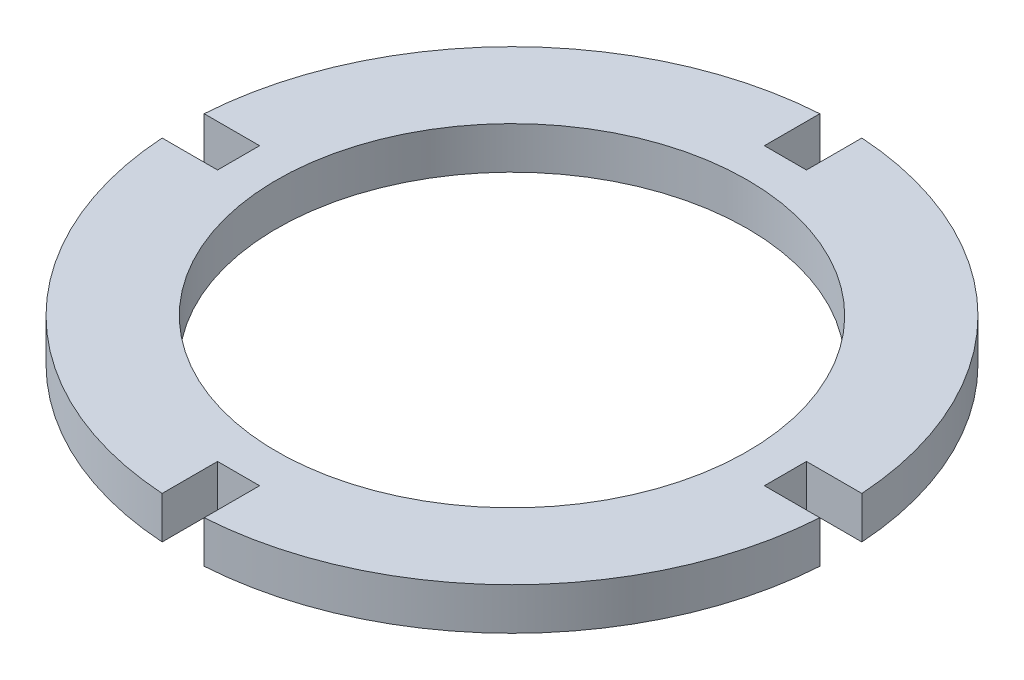
from build123d import *

# Parameters (mm, degrees)
SKICA4_R                 = 23.5
P_IDAT_VYSUNUT_M1_DEPTH  = 3
SKICA6_R                 = 16.78
ODEBRAT_VYSUNUT_M2_DEPTH = 3
SKICA7_W                 = 3
SKICA7_H                 = 6.382195619
SKICA7_W_2               = 6.382195619
SKICA7_H_2               = 3
ODEBRAT_VYSUNUT_M3_DEPTH = 3


with BuildPart() as part:
    # Skica4 → Přidat vysunutím1 (new body)
    with BuildSketch(Plane(origin=(0, 0, 0), x_dir=(1, 0, 0), z_dir=(0, 1, 0))):
        with Locations(Location((0, 0, 0), (0, 0, 270))):
            Circle(SKICA4_R)
    extrude(amount=P_IDAT_VYSUNUT_M1_DEPTH)

    # Skica6 → Odebrat vysunutím2 (cut)
    with BuildSketch(Plane.XZ):
        with Locations(Location((0, 0, 0), (0, 0, 270))):
            Circle(SKICA6_R)
    extrude(amount=-ODEBRAT_VYSUNUT_M2_DEPTH, mode=Mode.SUBTRACT)

    # Skica7 → Odebrat vysunutím3 (cut)
    with BuildSketch(Plane(origin=(0, 3, 0), x_dir=(1, 0, 0), z_dir=(0, 1, 0))):
        with Locations((0, -22.69109781)):
            Rectangle(SKICA7_W, SKICA7_H)
        with Locations((22.69109781, 0)):
            Rectangle(SKICA7_W_2, SKICA7_H_2)
        with Locations((-22.69109781, 0)):
            Rectangle(SKICA7_W_2, SKICA7_H_2)
        with Locations((0, 22.69109781)):
            Rectangle(SKICA7_W, SKICA7_H)
    extrude(amount=-ODEBRAT_VYSUNUT_M3_DEPTH, mode=Mode.SUBTRACT)


solid = part.part
